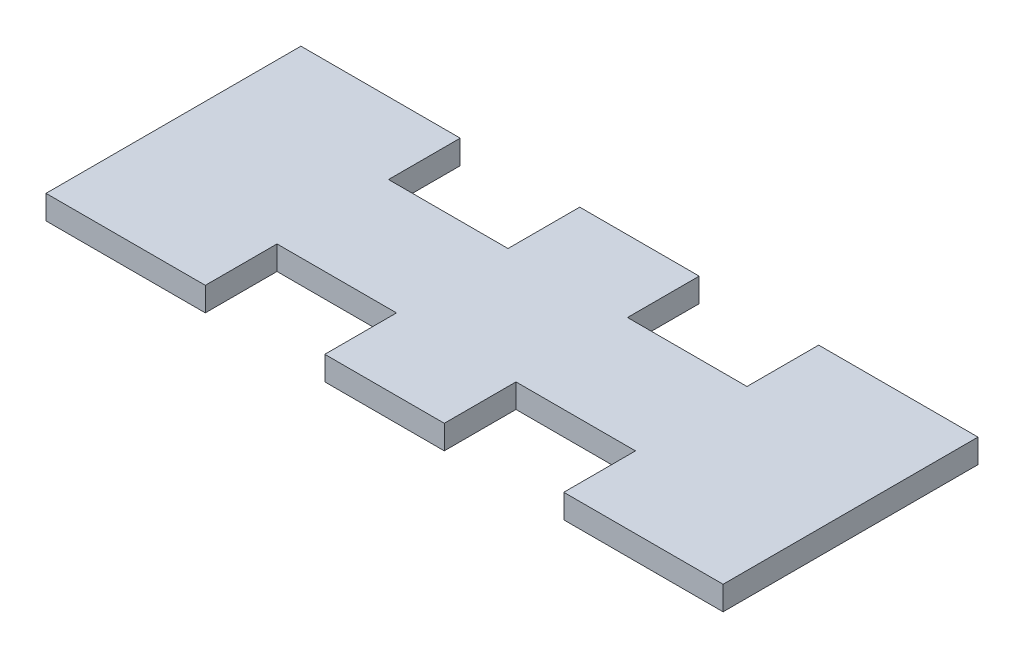
from build123d import *

# Parameters (mm, degrees)
SALIENTE_EXTRUIR1_DEPTH = 3


with BuildPart() as part:
    # Croquis1 → Saliente-Extruir1 (new body)
    with BuildSketch(Plane(origin=(0, 0, 0), x_dir=(1, 0, 0), z_dir=(0, 1, 0))):
        Polygon((0, 0), (20, 0), (20, 9), (35, 9), (35, 0), (50, 0), (50, 9), (65, 9), (65, 0), (85, 0), (85, 32), (65, 32), (65, 23), (50, 23), (50, 32), (35, 32), (35, 23), (20, 23), (20, 32), (0, 32), align=None)
    extrude(amount=SALIENTE_EXTRUIR1_DEPTH)


solid = part.part
